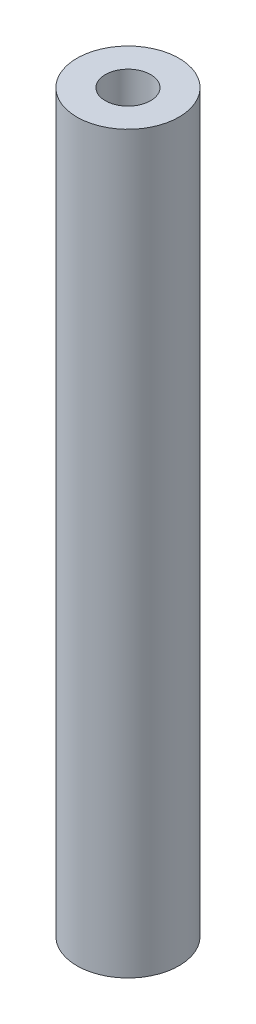
from build123d import *

# Parameters (mm, degrees)
SKETCH1_R           = 2.7
SKETCH1_R_2         = 1.2
BOSS_EXTRUDE1_DEPTH = 38.9


with BuildPart() as part:
    # Sketch1 → Boss-Extrude1 (new body)
    with BuildSketch(Plane(origin=(0, 0, 0), x_dir=(1, 0, 0), z_dir=(0, 1, 0))):
        with Locations(Location((0, 0, 0), (0, 0, 270))):
            Circle(SKETCH1_R)
        with Locations(Location((0, 0, 0), (0, 0, 270))):
            Circle(SKETCH1_R_2, mode=Mode.SUBTRACT)
    extrude(amount=BOSS_EXTRUDE1_DEPTH)


solid = part.part
